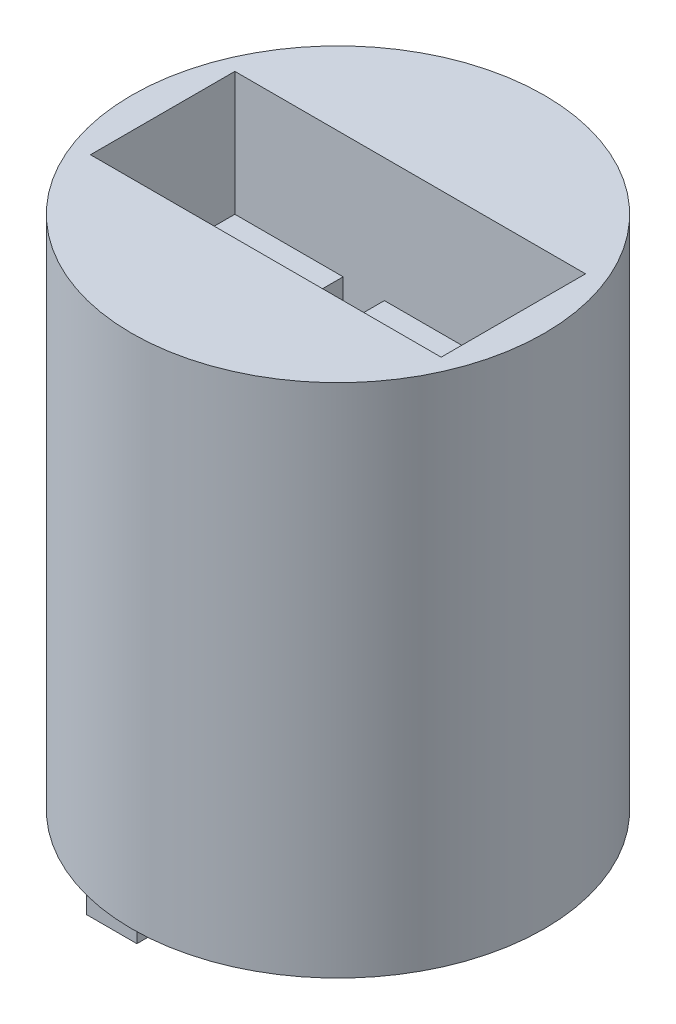
from build123d import *

# Parameters (mm, degrees)
SKETCH1_R           = 10
BOSS_EXTRUDE1_DEPTH = 25
SKETCH2_W           = 1.25
SKETCH2_H           = 5
BOSS_EXTRUDE2_DEPTH = 8
BOSS_EXTRUDE3_DEPTH = 1.2
SKETCH4_W           = 17
SKETCH4_H           = 7
CUT_EXTRUDE1_DEPTH  = 6
SKETCH5_W           = 2
SKETCH5_H           = 7
CUT_EXTRUDE2_DEPTH  = 4


with BuildPart() as part:
    # Sketch1 → Boss-Extrude1 (new body)
    with BuildSketch(Plane(origin=(0, 0, 0), x_dir=(1, 0, 0), z_dir=(0, 1, 0))):
        with Locations(Location((0, 0, 0), (0, 0, 270))):
            Circle(SKETCH1_R)
    extrude(amount=BOSS_EXTRUDE1_DEPTH)

    # Sketch4 → Cut-Extrude1 (cut)
    with BuildSketch(Plane(origin=(0, 25, 0), x_dir=(1, 0, 0), z_dir=(0, 1, 0))):
        Rectangle(SKETCH4_W, SKETCH4_H)
    extrude(amount=-CUT_EXTRUDE1_DEPTH, mode=Mode.SUBTRACT)

    # Sketch5 → Cut-Extrude2 (cut)
    with BuildSketch(Plane(origin=(0, 19, 0), x_dir=(1, 0, 0), z_dir=(0, 1, 0))):
        with Locations((-2.25, 0)):
            Rectangle(SKETCH5_W, SKETCH5_H)
    extrude(amount=-CUT_EXTRUDE2_DEPTH, mode=Mode.SUBTRACT)


with BuildPart() as body_2:
    # Sketch2 → Boss-Extrude2 (new body)
    with BuildSketch(Plane(origin=(0, 0, 0), x_dir=(-1, 0, 0), z_dir=(0, -1, 0))):
        with Locations((7.875, 0)):
            Rectangle(SKETCH2_W, SKETCH2_H)
    extrude(amount=BOSS_EXTRUDE2_DEPTH)

    # Sketch3 → Boss-Extrude3 (add)
    with BuildSketch(Plane.ZY.offset(8.5)):
        Polygon((-2.5, -8), (-2.5, 0), (2.5, 0), (2.5, -8), (1.5, -8), (1.5, -0.75), (-1.5, -0.75), (-1.5, -8), align=None)
    extrude(amount=BOSS_EXTRUDE3_DEPTH)


solid = Compound([part.part, body_2.part])
